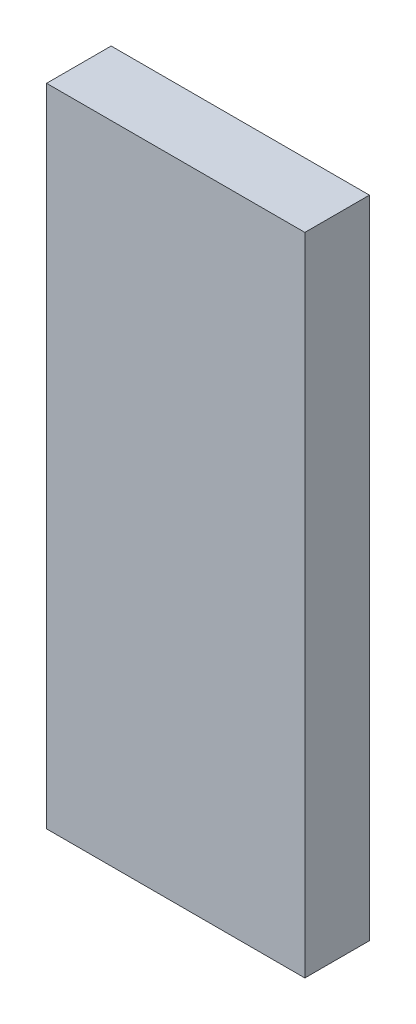
from build123d import *

# Parameters (mm, degrees)
SKETCH_1_W      = 20
SKETCH_1_H      = 50
EXTRUDE_1_DEPTH = 5


with BuildPart() as part:
    # Эскиз1 → Бобышка-Вытянуть1 (new body)
    with BuildSketch(Plane.XY):
        Rectangle(SKETCH_1_W, SKETCH_1_H)
    extrude(amount=EXTRUDE_1_DEPTH)


solid = part.part
